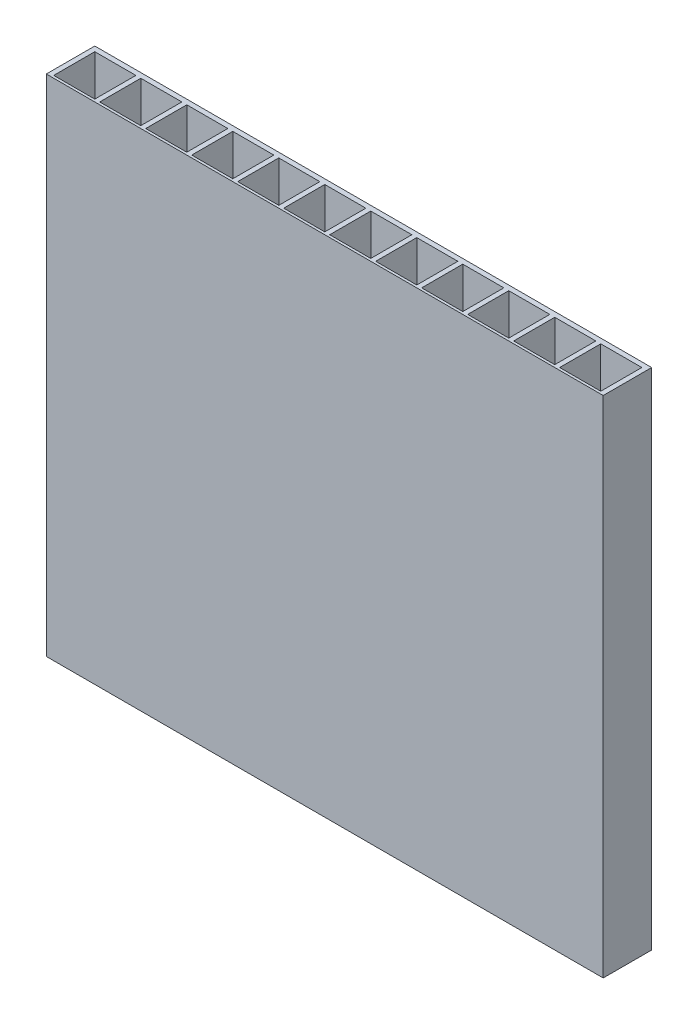
from build123d import *

# Parameters (mm, degrees)
SKETCH1_W           = 7.874
SKETCH1_H           = 7.874
SKETCH1_W_2         = 6.35
SKETCH1_H_2         = 6.35
BOSS_EXTRUDE1_DEPTH = 77.999999194
LPATTERN1_COUNT     = 12
LPATTERN1_PITCH     = 7.112
CUT_EXTRUDE1_START  = 3.937
SKETCH3_W           = 86.106
SKETCH3_H           = 77.999999194
CUT_EXTRUDE1_DEPTH  = 0.381


with BuildPart() as part:
    # Sketch1 → Boss-Extrude1 (new body)
    with BuildSketch(Plane(origin=(0, 0, 0), x_dir=(1, 0, 0), z_dir=(0, 1, 0))):
        Rectangle(SKETCH1_W, SKETCH1_H)
        Rectangle(SKETCH1_W_2, SKETCH1_H_2, mode=Mode.SUBTRACT)
    boss_extrude1 = extrude(amount=BOSS_EXTRUDE1_DEPTH)

    # LPattern1: Boss-Extrude1 ×12
    with Locations(*[(i * LPATTERN1_PITCH, 0, 0) for i in range(1, LPATTERN1_COUNT)]):
        add(boss_extrude1)

    # Sketch3 → Cut-Extrude1 (cut)
    with BuildSketch(Plane.XY.offset(CUT_EXTRUDE1_START)):
        with Locations((39.116, 38.999999597)):
            Rectangle(SKETCH3_W, SKETCH3_H)
    extrude(amount=-CUT_EXTRUDE1_DEPTH, mode=Mode.SUBTRACT)


solid = part.part
